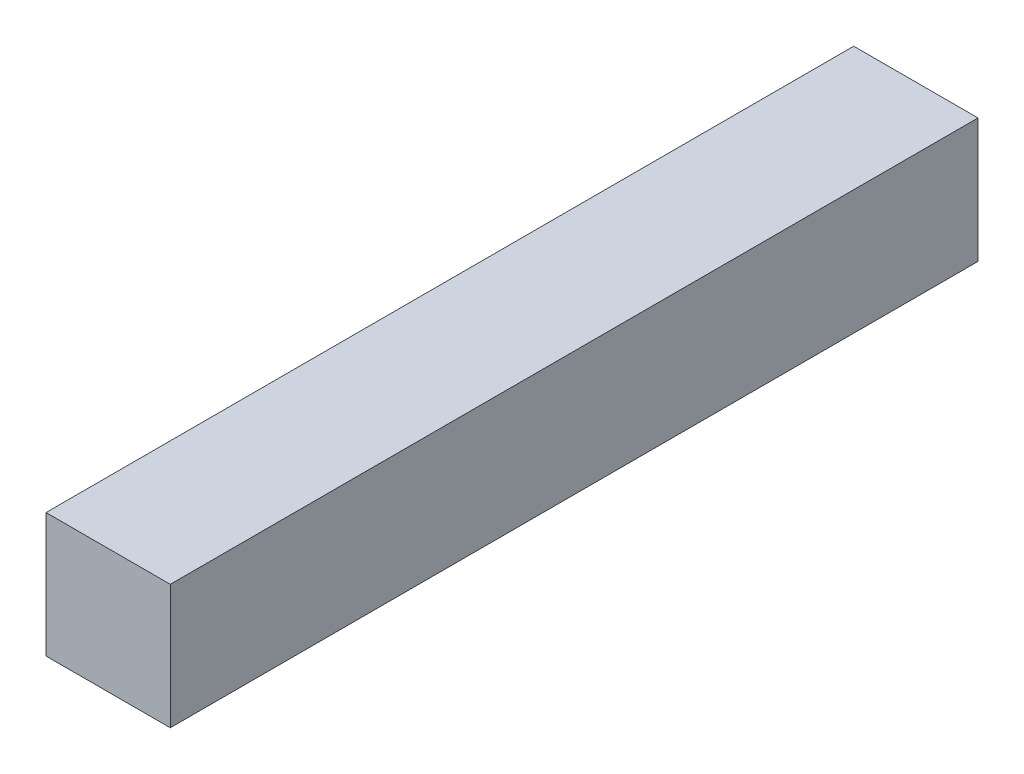
from build123d import *

# Parameters (mm, degrees)
SKETCH1_W           = 19.05
SKETCH1_H           = 19.05
BOSS_EXTRUDE1_DEPTH = 123.825


with BuildPart() as part:
    # Sketch1 → Boss-Extrude1 (new body)
    with BuildSketch(Plane.XY):
        Rectangle(SKETCH1_W, SKETCH1_H)
    extrude(amount=BOSS_EXTRUDE1_DEPTH)


solid = part.part
